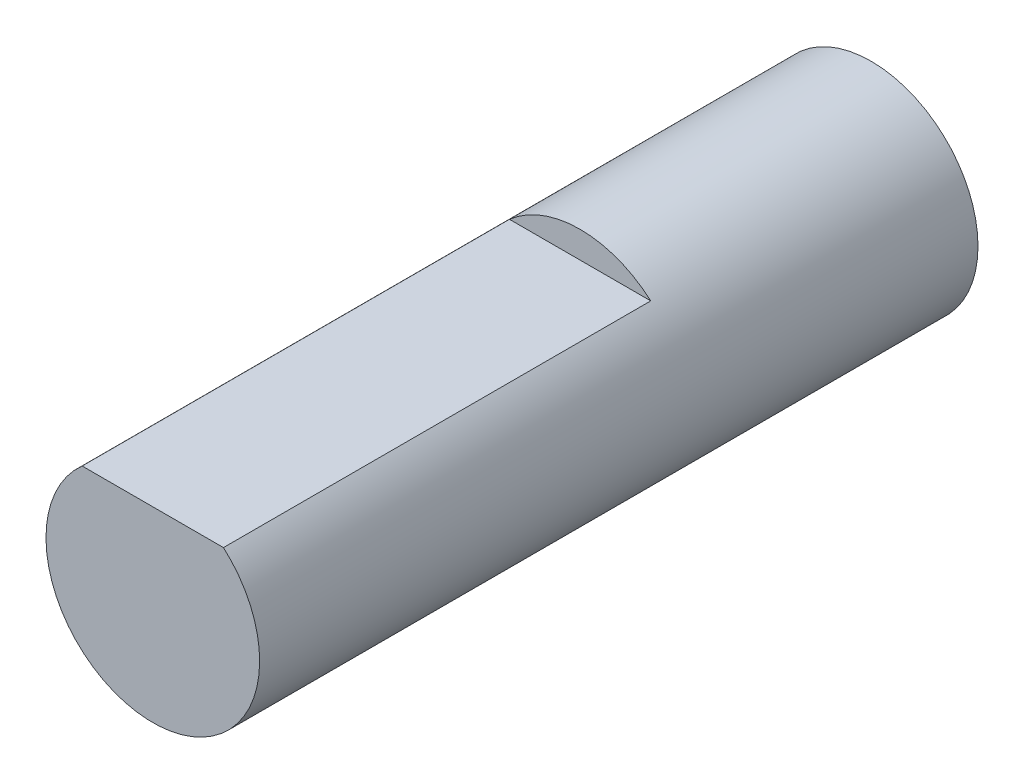
from build123d import *

# Parameters (mm, degrees)
F_01_START                                    = -0.95
S01_ROUND_ROOT_OF_MOTOR_SHAFT_R               = 2
F_01_ROUND_ROOT_OF_MOTOR_SHAFT_DEPTH          = 5.45
F_02_START                                    = 4.5
F_02_4_MM_SHAFT_WITH_3_5_MM_ACROSS_FLAT_DEPTH = 8


with BuildPart() as part:
    # S01 - Round root of motor shaft → 01 - Round root of motor shaft (new body)
    with BuildSketch(Plane.XY.offset(F_01_START)):
        Circle(S01_ROUND_ROOT_OF_MOTOR_SHAFT_R)
    extrude(amount=F_01_ROUND_ROOT_OF_MOTOR_SHAFT_DEPTH)

    # S02 - 4 mm shaft with 3.5 mm across flat → 02 - 4 mm shaft with 3.5 mm across flat (add)
    with BuildSketch(Plane.XY.offset(F_02_START)):
        with BuildLine():
            Line((-1.322875656, 1.5), (1.322875656, 1.5))
            ThreePointArc((1.322875656, 1.5), (0, -2), (-1.322875656, 1.5))
        make_face()
    extrude(amount=F_02_4_MM_SHAFT_WITH_3_5_MM_ACROSS_FLAT_DEPTH)


solid = part.part
